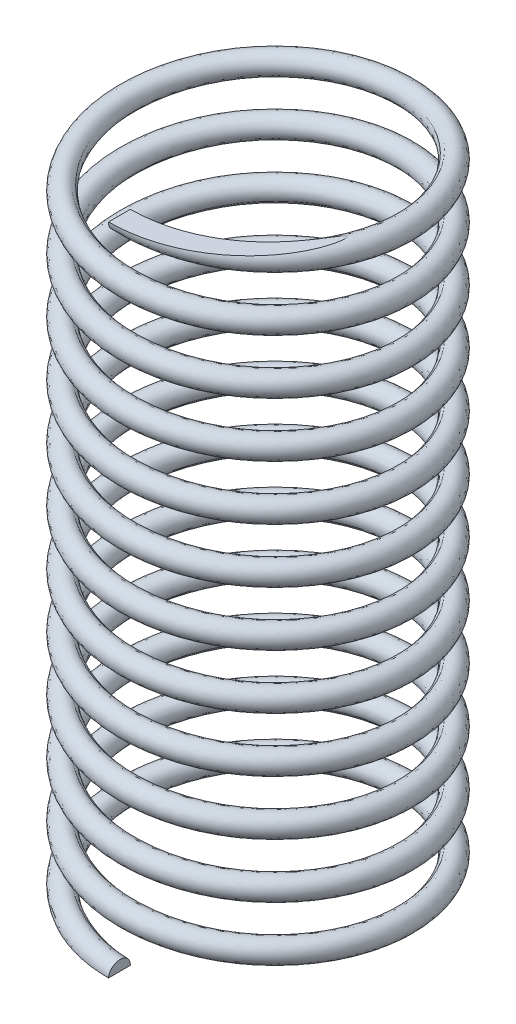
from build123d import *

# Parameters (mm, degrees)
BALAYAGE1_PITCH              = 1.25
BALAYAGE1_HEIGHT             = 15
BALAYAGE1_RADIUS             = 3.175
ESQUISSE3_R                  = 0.25
ENL_V_MAT_EXTRU_1_DEPTH      = 10
ENL_V_MAT_EXTRU_1_DEPTH_BACK = 10
ESQUISSE4_W                  = 14.32855061
ESQUISSE4_H                  = 17.385859226
ESQUISSE4_W_2                = 16.629686146
ESQUISSE4_H_2                = 2.729970364


with BuildPart() as part:
    # Balayage1: sweep along a helix
    with BuildLine() as balayage1_path:
        Helix(BALAYAGE1_PITCH, BALAYAGE1_HEIGHT, BALAYAGE1_RADIUS, center=(0, 0, 0), direction=(0, 1, 0), lefthand=True)
    # Esquisse3 → Balayage1 (sweep)
    with BuildSketch(Plane(origin=(0, 15, 3.175), x_dir=(0, 0, 1), z_dir=(-0.9980426599454852, 0.06253678060901982, -1.677027399086997e-13))):
        Circle(ESQUISSE3_R)
    sweep(path=balayage1_path.line, is_frenet=True)

    # Esquisse4 → Enlèv. mat.-Extru.1 (cut, two sides: drawn at the far end of the back side and taken through both)
    with BuildSketch(Plane(origin=(0, 10, 3.5), x_dir=(0, 0, 1), z_dir=(-1, 0, 0)).offset(-ENL_V_MAT_EXTRU_1_DEPTH_BACK)):
        with Locations((-4.164012333, 13.692929613)):
            Rectangle(ESQUISSE4_W, ESQUISSE4_H)
        with Locations((-3.643604621, -11.364985182)):
            Rectangle(ESQUISSE4_W_2, ESQUISSE4_H_2)
    extrude(amount=ENL_V_MAT_EXTRU_1_DEPTH + ENL_V_MAT_EXTRU_1_DEPTH_BACK, mode=Mode.SUBTRACT)


solid = part.part
